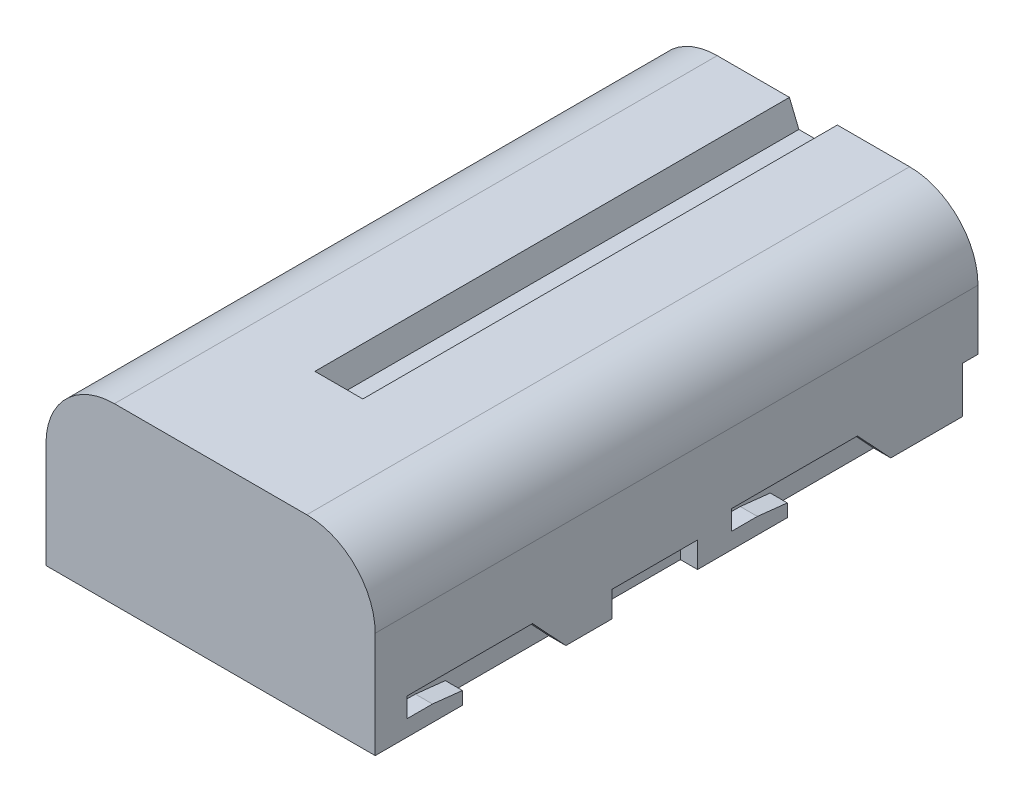
from build123d import *

# Parameters (mm, degrees)
SKETCH_1_R          = 8
SKETCH_1_W          = 38.5
SKETCH_1_H          = 12.4
SKETCH_1_W_2        = 22.5
SKETCH_1_H_2        = 8
EXTRUDE_1_DEPTH     = 35.25
CUT_EXTRUDE_1_DEPTH = 55.5
SKETCH_3_W          = 1.8
SKETCH_3_H          = 5.4
SKETCH_3_W_2        = 10
SKETCH_3_H_2        = 3
CUT_EXTRUDE_2_DEPTH = 2
SKETCH_4_W          = 1.8
SKETCH_4_H          = 5.4
CUT_EXTRUDE_3_DEPTH = 4.5


with BuildPart() as part:
    # 草图1 → 凸台-拉伸1 (new, symmetric)
    with BuildSketch(Plane.XY):
        with Locations((-11.25, 2.2)):
            Circle(SKETCH_1_R)
        with Locations((11.25, 2.2)):
            Circle(SKETCH_1_R)
        with Locations((0, -4)):
            Rectangle(SKETCH_1_W, SKETCH_1_H)
        with Locations((0, 6.2)):
            Rectangle(SKETCH_1_W_2, SKETCH_1_H_2)
    extrude(amount=EXTRUDE_1_DEPTH, both=True)

    # 草图2 → 切除-拉伸1 (cut)
    with BuildSketch(Plane(origin=(0, 0, -35.25), x_dir=(-1, 0, 0), z_dir=(0, 0, -1))):
        Polygon((-2.8, 10.2), (2.8, 10.2), (1.7, 7.5), (-1.7, 7.5), align=None)
    cut_extrude_1 = extrude(amount=-CUT_EXTRUDE_1_DEPTH, mode=Mode.SUBTRACT)

    # 草图3 → 切除-拉伸2 (cut)
    with BuildSketch(Plane.ZY.offset(19.25)):
        with Locations((-34.35, -7.5)):
            Rectangle(SKETCH_3_W, SKETCH_3_H)
        Polygon((-25.05, -10.2), (-21.15, -6.017762031), (-6.45, -6.017762031), (-6.45, -8.317762031), (-9.45, -8.317762031), (-12.95, -8.7), (-12.95, -10.2), align=None)
        with Locations((2.55, -8.7)):
            Rectangle(SKETCH_3_W_2, SKETCH_3_H_2)
        Polygon((12.95, -10.2), (16.85, -6.017762031), (31.55, -6.017762031), (31.55, -8.317762031), (28.55, -8.317762031), (25.05, -8.7), (25.05, -10.2), align=None)
    cut_extrude_2 = extrude(amount=-CUT_EXTRUDE_2_DEPTH, mode=Mode.SUBTRACT)

    # 草图4 → 切除-拉伸3 (cut)
    with BuildSketch(Plane.ZY.offset(17.25)):
        with Locations((-34.35, -7.5)):
            Rectangle(SKETCH_4_W, SKETCH_4_H)
    cut_extrude_3 = extrude(amount=-CUT_EXTRUDE_3_DEPTH, mode=Mode.SUBTRACT)

    # 镜向1: 切除-拉伸1, 切除-拉伸2, 切除-拉伸3 across plane
    add(cut_extrude_1.mirror(Plane(origin=(0, 0, 0), x_dir=(0, 0, 1), z_dir=(1, 0, 0))), mode=Mode.SUBTRACT)
    add(cut_extrude_2.mirror(Plane(origin=(0, 0, 0), x_dir=(0, 0, 1), z_dir=(1, 0, 0))), mode=Mode.SUBTRACT)
    add(cut_extrude_3.mirror(Plane(origin=(0, 0, 0), x_dir=(0, 0, 1), z_dir=(1, 0, 0))), mode=Mode.SUBTRACT)


solid = part.part
